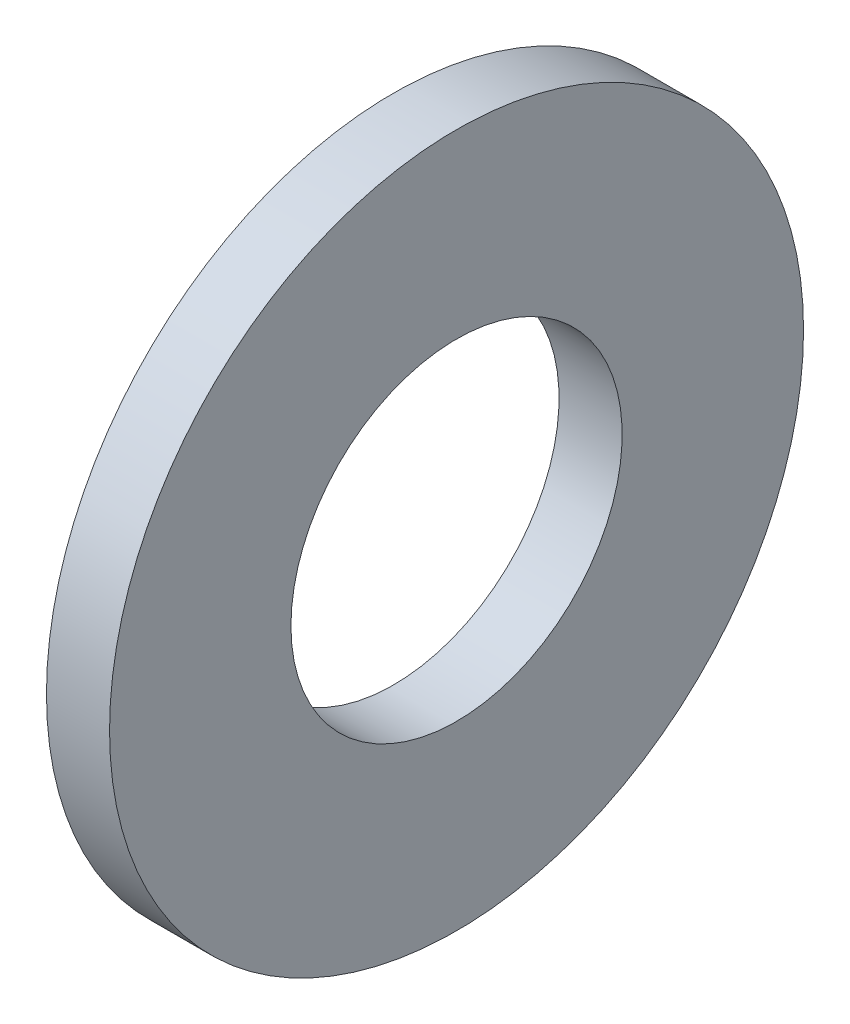
from build123d import *

# Parameters (mm, degrees)
ESQUISSE1_W = 2
ESQUISSE1_H = 5.75


with BuildPart() as part:
    # Esquisse1 → Base-Révolution (revolve)
    with BuildSketch(Plane(origin=(0, 0, 0), x_dir=(1, 0, 0), z_dir=(0, 1, 0))):
        with Locations((1, 8.125)):
            Rectangle(ESQUISSE1_W, ESQUISSE1_H)
    revolve(axis=Axis((0, 0, 0), (1, 0, 0)))


solid = part.part
